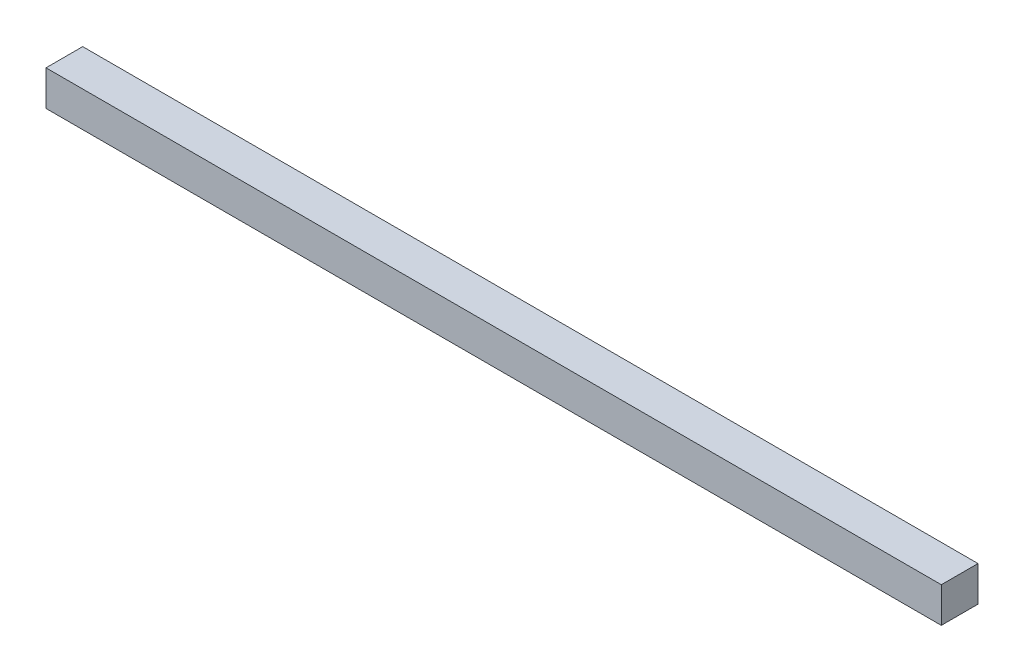
from build123d import *

# Parameters (mm, degrees)
SKETCH1_W            = 330
SKETCH1_H            = 275
SKETCH1_W_2          = 305
SKETCH1_H_2          = 250
BOSS_EXTRUDE4_DEPTH  = 12
BOSS_EXTRUDE6_DEPTH  = 12.5
BOSS_EXTRUDE7_DEPTH  = 12.5
SKETCH6_R            = 15
SKETCH6_R_2          = 11
BOSS_EXTRUDE8_DEPTH  = 12.5
SKETCH7_R            = 11
CUT_EXTRUDE2_DEPTH   = 383.003996993
BOSS_EXTRUDE9_REACH  = 283.371
SKETCH8_W            = 12.5
SKETCH8_H            = 10
BOSS_EXTRUDE10_REACH = 283.371
SKETCH9_W            = 12.5
SKETCH9_H            = 10
SKETCH10_W           = 25
SKETCH10_H           = 25
BOSS_EXTRUDE11_DEPTH = 12.5
SKETCH13_W           = 298.504377872
SKETCH13_H           = 174.029548168
CUT_EXTRUDE4_DEPTH   = 12.5
SKETCH14_W           = 182.395956461
SKETCH14_H           = 93.31192128
CUT_EXTRUDE5_DEPTH   = 71.5
SKETCH15_W           = 335.295700941
SKETCH15_H           = 100.118716731
CUT_EXTRUDE6_DEPTH   = 12.5
SKETCH16_W           = 69.396880986
SKETCH16_H           = 36.294815257
CUT_EXTRUDE7_DEPTH   = 362.5


with BuildPart() as part:
    # Sketch1 → Boss-Extrude4 (new body)
    with BuildSketch(Plane(origin=(0, 0, 0), x_dir=(1, 0, 0), z_dir=(0, 1, 0))):
        Rectangle(SKETCH1_W, SKETCH1_H)
        Rectangle(SKETCH1_W_2, SKETCH1_H_2, mode=Mode.SUBTRACT)
    extrude(amount=BOSS_EXTRUDE4_DEPTH)

    # Sketch2 → Boss-Extrude6 (add)
    with BuildSketch(Plane(origin=(165, 0, 0), x_dir=(0, 0, -1), z_dir=(1, 0, 0))):
        Polygon((0, 152), (-137.5, 12), (-127.5, 12), (0, 141.818181818), (127.5, 12), (137.5, 12), align=None)
    extrude(amount=-BOSS_EXTRUDE6_DEPTH)

    # Sketch5 → Boss-Extrude7 (add)
    with BuildSketch(Plane.ZY.offset(165)):
        Polygon((0, 152), (-137.5, 12), (-127.5, 12), (0, 141.818181818), (127.5, 12), (137.5, 12), align=None)
    extrude(amount=-BOSS_EXTRUDE7_DEPTH)

    # Sketch6 → Boss-Extrude8 (add)
    with BuildSketch(Plane.ZY.offset(-152.5)):
        with Locations((0, 146.909090909)):
            Circle(SKETCH6_R)
        with Locations((0, 146.909090909)):
            Circle(SKETCH6_R_2, mode=Mode.SUBTRACT)
    extrude(amount=-BOSS_EXTRUDE8_DEPTH)

    # Sketch7 → Cut-Extrude2 (cut, through all)
    with BuildSketch(Plane.ZY.offset(-152.5)):
        with Locations((0, 146.909090909)):
            Circle(SKETCH7_R)
    extrude(amount=-CUT_EXTRUDE2_DEPTH, mode=Mode.SUBTRACT)

    # Boss-Extrude9: up to this plane
    boss_extrude9_end = Plane(origin=(0, 12, 0), z_dir=(0, -1, 0))
    # Sketch8 → Boss-Extrude9 (add, up to the surface)
    with BuildSketch(Plane(origin=(0, 69.631553319, 70.897581561), x_dir=(-1, 0, 0), z_dir=(0, -0.7007080148842544, -0.7134481606094221)), mode=Mode.PRIVATE) as boss_extrude9_sk1:
        with Locations((-158.75, 10.200513494)):
            Rectangle(SKETCH8_W, SKETCH8_H)
    boss_extrude9_tool1 = split(extrude(boss_extrude9_sk1.sketch, amount=BOSS_EXTRUDE9_REACH, mode=Mode.PRIVATE), bisect_by=boss_extrude9_end, keep=Keep.BOTH, mode=Mode.PRIVATE)
    add(boss_extrude9_tool1.solids().sort_by_distance((158.75, 76.909091, 63.75))[0])
    # Sketch8 → Boss-Extrude9 (add, up to the surface)
    with BuildSketch(Plane(origin=(0, 69.631553319, 70.897581561), x_dir=(-1, 0, 0), z_dir=(0, -0.7007080148842544, -0.7134481606094221)), mode=Mode.PRIVATE) as boss_extrude9_sk2:
        with Locations((158.75, 10.200513494)):
            Rectangle(SKETCH8_W, SKETCH8_H)
    boss_extrude9_tool2 = split(extrude(boss_extrude9_sk2.sketch, amount=BOSS_EXTRUDE9_REACH, mode=Mode.PRIVATE), bisect_by=boss_extrude9_end, keep=Keep.BOTH, mode=Mode.PRIVATE)
    add(boss_extrude9_tool2.solids().sort_by_distance((-158.75, 76.909091, 63.75))[0])

    # Boss-Extrude10: up to this plane
    boss_extrude10_end = Plane(origin=(0, 12, 0), z_dir=(0, -1, 0))
    # Sketch9 → Boss-Extrude10 (add, up to the surface)
    with BuildSketch(Plane(origin=(0, 69.631553319, -70.897581561), x_dir=(1, 0, 0), z_dir=(0, -0.7007080148842544, 0.7134481606094221)), mode=Mode.PRIVATE) as boss_extrude10_sk1:
        with Locations((-158.75, 10.200513494)):
            Rectangle(SKETCH9_W, SKETCH9_H)
    boss_extrude10_tool1 = split(extrude(boss_extrude10_sk1.sketch, amount=BOSS_EXTRUDE10_REACH, mode=Mode.PRIVATE), bisect_by=boss_extrude10_end, keep=Keep.BOTH, mode=Mode.PRIVATE)
    add(boss_extrude10_tool1.solids().sort_by_distance((-158.75, 76.909091, -63.75))[0])
    # Sketch9 → Boss-Extrude10 (add, up to the surface)
    with BuildSketch(Plane(origin=(0, 69.631553319, -70.897581561), x_dir=(1, 0, 0), z_dir=(0, -0.7007080148842544, 0.7134481606094221)), mode=Mode.PRIVATE) as boss_extrude10_sk2:
        with Locations((158.75, 10.200513494)):
            Rectangle(SKETCH9_W, SKETCH9_H)
    boss_extrude10_tool2 = split(extrude(boss_extrude10_sk2.sketch, amount=BOSS_EXTRUDE10_REACH, mode=Mode.PRIVATE), bisect_by=boss_extrude10_end, keep=Keep.BOTH, mode=Mode.PRIVATE)
    add(boss_extrude10_tool2.solids().sort_by_distance((158.75, 76.909091, -63.75))[0])

    # Sketch10 → Boss-Extrude11 (add)
    with BuildSketch(Plane(origin=(-152.5, 0, 0), x_dir=(0, 0, -1), z_dir=(1, 0, 0))):
        with Locations((0, 146.909090909)):
            Rectangle(SKETCH10_W, SKETCH10_H)
    extrude(amount=-BOSS_EXTRUDE11_DEPTH)

    # Sketch11 → Revolve1 (revolve)
    with BuildSketch(Plane.XY, mode=Mode.PRIVATE) as revolve1_sk:
        with BuildLine():
            Line((152.5, 157.909090909), (152.5, 161.909090909))
            ThreePointArc((152.5, 161.909090909), (149.508436085, 160.260408588), (146.516872171, 161.909090909))
            Line((146.516872171, 161.909090909), (146.516872171, 157.909090909))
            Line((146.516872171, 157.909090909), (152.5, 157.909090909))
        make_face()
    revolve(revolve1_sk.sketch.rotate(Axis((152.5, 146.909090909, 0), (-1, 0, 0)), 270), axis=Axis((152.5, 146.909090909, 0), (-1, 0, 0)))

    # Sketch13 → Cut-Extrude4 (cut)
    with BuildSketch(Plane.ZY.offset(165)):
        with Locations((11.752188936, 87.014774084)):
            Rectangle(SKETCH13_W, SKETCH13_H)
    extrude(amount=-CUT_EXTRUDE4_DEPTH, mode=Mode.SUBTRACT)

    # Sketch14 → Cut-Extrude5 (cut)
    with BuildSketch(Plane(origin=(165, 0, 0), x_dir=(0, 0, -1), z_dir=(1, 0, 0))):
        with Locations((23.675931825, 129.906240663)):
            Rectangle(SKETCH14_W, SKETCH14_H)
    extrude(amount=-CUT_EXTRUDE5_DEPTH, mode=Mode.SUBTRACT)

    # Sketch15 → Cut-Extrude6 (cut)
    with BuildSketch(Plane(origin=(165, 0, 0), x_dir=(0, 0, -1), z_dir=(1, 0, 0))):
        with Locations((30.147850471, 50.059358366)):
            Rectangle(SKETCH15_W, SKETCH15_H)
    extrude(amount=-CUT_EXTRUDE6_DEPTH, mode=Mode.SUBTRACT)


with BuildPart() as cut_extrude6_piece_1:
    # of the separate pieces the step leaves, piece 1, a body of its own (cut_extrude6_pieces)
    add(part.part.solids().sort_by_distance((-152.5, 0, 137.5))[0])


with BuildPart() as cut_extrude6_piece_2:
    # of the separate pieces the step leaves, piece 2, a body of its own (cut_extrude6_pieces)
    add(part.part.solids().sort_by_distance((152.5, 0, -125))[0])

    # Sketch16 → Cut-Extrude7 (cut)
    with BuildSketch(Plane(origin=(152.5, 0, 0), x_dir=(0, 0, -1), z_dir=(1, 0, 0))):
        with Locations((159.698440493, 18.147407629)):
            Rectangle(SKETCH16_W, SKETCH16_H)
    extrude(amount=-CUT_EXTRUDE7_DEPTH, mode=Mode.SUBTRACT)


solid = cut_extrude6_piece_1.part
